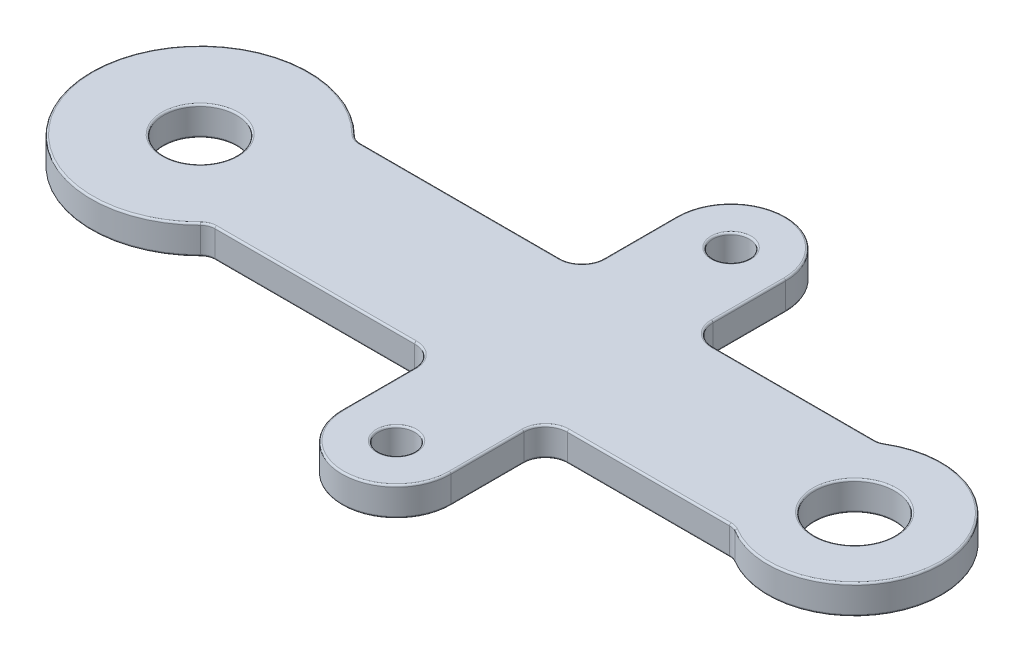
from build123d import *

# Parameters (mm, degrees)
SKETCH_1_R      = 10
SKETCH_1_R_2    = 5
SKETCH_1_R_3    = 11
EXTRUDE_1_DEPTH = 8
FILLET_1_R      = 6
FILLET_2_R      = 6
FILLET_3_R      = 6
FILLET_4_R      = 6
FILLET_5_R      = 4
FILLET_6_R      = 4
FILLET_7_R      = 4
FILLET_8_R      = 4
FILLET_9_R      = 0.5


with BuildPart() as part:
    # 草图1 → 凸台-拉伸1 (new body)
    with BuildSketch(Plane(origin=(0, 0, 0), x_dir=(1, 0, 0), z_dir=(0, 1, 0))):
        with BuildLine():
            Line((22.356307591, 20.004887175), (85, 20.004887175))
            Line((85, 20.004887175), (85, 46))
            ThreePointArc((85, 46), (100, 61), (115, 46))
            Line((115, 46), (115, 20.004887175))
            Line((115, 20.004887175), (166.74087148, 20.004887175))
            ThreePointArc((166.74087148, 20.004887175), (204, 0), (166.74087148, -20.004887175))
            Line((166.74087148, -20.004887175), (115, -20.004887175))
            Line((115, -20.004887175), (115, -46))
            ThreePointArc((115, -46), (100, -61), (85, -46))
            Line((85, -46), (85, -20.004887175))
            Line((85, -20.004887175), (22.356307591, -20.004887175))
            ThreePointArc((22.356307591, -20.004887175), (-30, 0), (22.356307591, 20.004887175))
        make_face()
        with Locations(Location((0, 0, 0), (0, 0, 270))):
            Circle(SKETCH_1_R, mode=Mode.SUBTRACT)
        with Locations(Location((100, 46, 0), (0, 0, 270))):
            Circle(SKETCH_1_R_2, mode=Mode.SUBTRACT)
        with Locations(Location((180, 0, 0), (0, 0, 270))):
            Circle(SKETCH_1_R_3, mode=Mode.SUBTRACT)
        with Locations(Location((100, -46, 0), (0, 0, 90))):
            Circle(SKETCH_1_R_2, mode=Mode.SUBTRACT)
    extrude(amount=EXTRUDE_1_DEPTH)

    # 圆角1
    fillet_1_edges = [part.edges().sort_by_distance(p)[0] for p in [
        (85, 4, -20.004887175),
    ]]
    fillet(fillet_1_edges, radius=FILLET_1_R)

    # 圆角2
    fillet_2_edges = [part.edges().sort_by_distance(p)[0] for p in [
        (115, 4, -20.004887175),
    ]]
    fillet(fillet_2_edges, radius=FILLET_2_R)

    # 圆角3
    fillet_3_edges = [part.edges().sort_by_distance(p)[0] for p in [
        (115, 4, 20.004887175),
    ]]
    fillet(fillet_3_edges, radius=FILLET_3_R)

    # 圆角4
    fillet_4_edges = [part.edges().sort_by_distance(p)[0] for p in [
        (85, 4, 20.004887175),
    ]]
    fillet(fillet_4_edges, radius=FILLET_4_R)

    # 圆角5
    fillet_5_edges = [part.edges().sort_by_distance(p)[0] for p in [
        (22.356307591, 4, -20.004887175),
    ]]
    fillet(fillet_5_edges, radius=FILLET_5_R)

    # 圆角6
    fillet_6_edges = [part.edges().sort_by_distance(p)[0] for p in [
        (22.356307591, 4, 20.004887175),
    ]]
    fillet(fillet_6_edges, radius=FILLET_6_R)

    # 圆角7
    fillet_7_edges = [part.edges().sort_by_distance(p)[0] for p in [
        (166.74087148, 4, 20.004887175),
    ]]
    fillet(fillet_7_edges, radius=FILLET_7_R)

    # 圆角8
    fillet_8_edges = [part.edges().sort_by_distance(p)[0] for p in [
        (166.74087148, 4, -20.004887175),
    ]]
    fillet(fillet_8_edges, radius=FILLET_8_R)

    # 圆角9
    fillet_9_edges = [part.edges().sort_by_distance(p)[0] for p in [
        (22.544762773, 8, -20.310538958),
        (51.539158938, 0, 20.004887175),
        (51.539158938, 8, 20.004887175),
        (22.544762773, 8, 20.310538958),
        (22.544762773, 0, 20.310538958),
        (85, 0, -36.002443588),
        (100, 0, -61),
        (204, 0, 0),
        (204, 8, 0),
        (166.654322464, 8, 20.150209602),
        (166.654322464, 0, 20.150209602),
        (143.292965386, 0, -20.004887175),
        (100, 8, 61),
        (143.292965386, 8, -20.004887175),
        (166.654322464, 8, -20.150209602),
        (166.654322464, 0, -20.150209602),
        (115, 0, 36.002443588),
        (100, 0, 61),
        (115, 8, 36.002443588),
        (0, 0, -10),
        (0, 8, -10),
        (100, 8, -61),
        (100, 0, -51),
        (100, 8, -51),
        (85, 8, -36.002443588),
        (100, 0, 51),
        (100, 8, 51),
        (180, 0, -11),
        (180, 8, -11),
        (51.539158938, 0, -20.004887175),
        (51.539158938, 8, -20.004887175),
        (83.242640687, 0, -21.762246488),
        (83.242640687, 8, -21.762246488),
        (115, 0, -36.002443588),
        (115, 8, -36.002443588),
        (116.757359313, 8, -21.762246488),
        (116.757359313, 0, -21.762246488),
        (143.292965386, 0, 20.004887175),
        (143.292965386, 8, 20.004887175),
        (116.757359313, 8, 21.762246488),
        (116.757359313, 0, 21.762246488),
        (85, 0, 36.002443588),
        (85, 8, 36.002443588),
        (83.242640687, 8, 21.762246488),
        (83.242640687, 0, 21.762246488),
        (-30, 0, 0),
        (-30, 8, 0),
        (22.544762773, 0, -20.310538958),
    ]]
    fillet(fillet_9_edges, radius=FILLET_9_R)


solid = part.part
